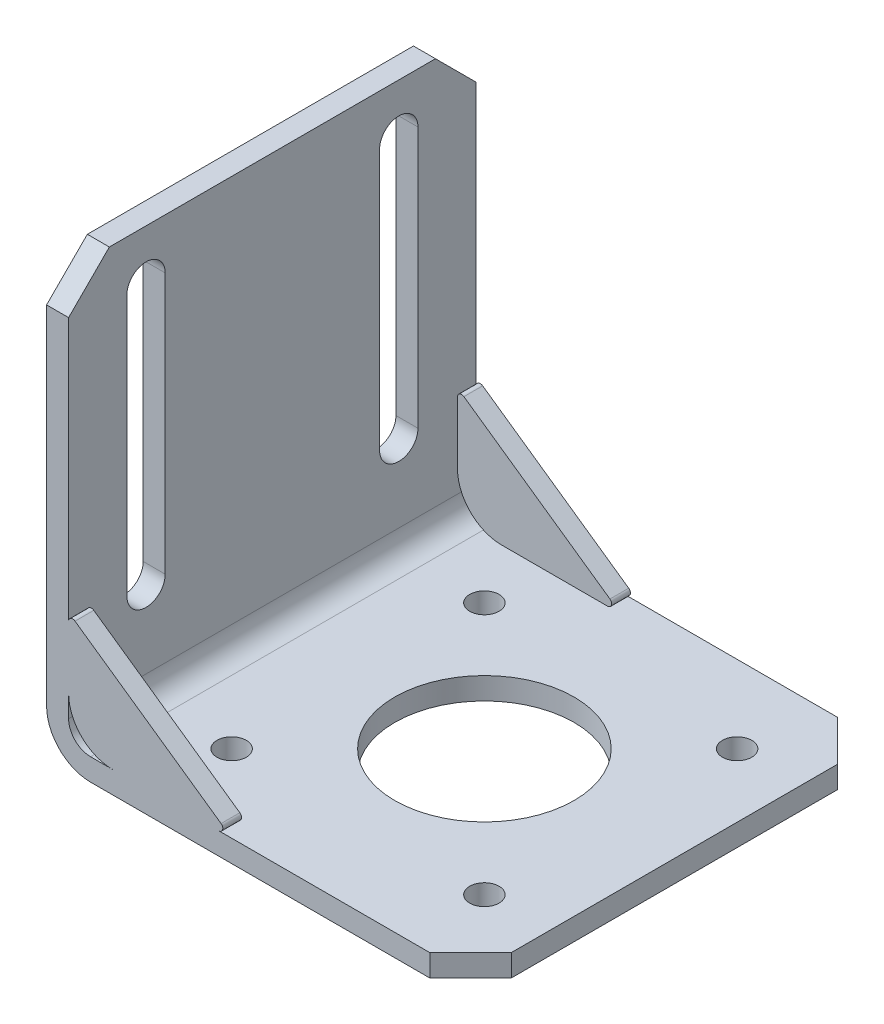
from build123d import *

# Parameters (mm, degrees)
BOSS_EXTRUDE1_DEPTH = 25
SKETCH3_R           = 11
SKETCH3_R_2         = 1.8
CUT_EXTRUDE1_DEPTH  = 50
CHAMFER1_SIZE       = 5
CUT_EXTRUDE2_DEPTH  = 50
BOSS_EXTRUDE2_DEPTH = 2.3


with BuildPart() as part:
    # Sketch1 → Boss-Extrude1 (new, symmetric)
    with BuildSketch(Plane.XY):
        with BuildLine():
            Line((0, 53), (0, 5.4))
            ThreePointArc((0, 5.4), (1.581623382, 1.581623382), (5.4, 0))
            Line((5.4, 0), (52, 0))
            Line((52, 0), (52, 2.7))
            Line((52, 2.7), (5.4, 2.7))
            ThreePointArc((5.4, 2.7), (3.490811691, 3.490811691), (2.7, 5.4))
            Line((2.7, 5.4), (2.7, 53))
            Line((2.7, 53), (0, 53))
        make_face()
    extrude(amount=BOSS_EXTRUDE1_DEPTH, both=True)

    # Sketch3 → Cut-Extrude1 (cut)
    with BuildSketch(Plane(origin=(0, 2.7, 0), x_dir=(1, 0, 0), z_dir=(0, 1, 0))):
        with Locations(Location((28.7, 0, 0), (0, 0, 270))):
            Circle(SKETCH3_R)
        with Locations(Location((44.2, 15.5, 0), (0, 0, 270))):
            Circle(SKETCH3_R_2)
        with Locations(Location((44.2, -15.5, 0), (0, 0, 270))):
            Circle(SKETCH3_R_2)
        with Locations(Location((13.2, -15.5, 0), (0, 0, 270))):
            Circle(SKETCH3_R_2)
        with Locations(Location((13.2, 15.5, 0), (0, 0, 270))):
            Circle(SKETCH3_R_2)
    extrude(amount=-CUT_EXTRUDE1_DEPTH, mode=Mode.SUBTRACT)

    # Chamfer1
    chamfer1_edges = [part.edges().sort_by_distance(p)[0] for p in [
        (1.35, 53, -25),
        (52, 1.35, 25),
        (1.35, 53, 25),
        (52, 1.35, -25),
    ]]
    chamfer(chamfer1_edges, length=CHAMFER1_SIZE)

    # Sketch4 → Cut-Extrude2 (cut)
    with BuildSketch(Plane(origin=(2.7, 0, 0), x_dir=(0, 0, -1), z_dir=(1, 0, 0))):
        with BuildLine():
            Line((-17.851169652, 14.819907576), (-17.851169652, 46.819907056))
            ThreePointArc((-17.851169652, 46.819907056), (-15.5, 49.171076708), (-13.148830348, 46.819907056))
            Line((-13.148830348, 46.819907056), (-13.148830348, 14.819907576))
            ThreePointArc((-13.148830348, 14.819907576), (-15.5, 12.468737404), (-17.851169652, 14.819907576))
        make_face()
        with BuildLine():
            Line((13.148830348, 14.819907576), (13.148830348, 46.819907056))
            ThreePointArc((13.148830348, 46.819907056), (15.5, 49.171076708), (17.851169652, 46.819907056))
            Line((17.851169652, 46.819907056), (17.851169652, 14.819907576))
            ThreePointArc((17.851169652, 14.819907576), (15.5, 12.468737404), (13.148830348, 14.819907576))
        make_face()
    extrude(amount=-CUT_EXTRUDE2_DEPTH, mode=Mode.SUBTRACT)


with BuildPart() as body_2:
    # Sketch5 → Boss-Extrude2 (new body)
    with BuildSketch(Plane(origin=(0, 0, -25), x_dir=(-1, 0, 0), z_dir=(0, 0, -1))):
        with BuildLine():
            Line((-3.486731172, 16.149288179), (-21.400548628, 3.60961596))
            ThreePointArc((-21.400548628, 3.60961596), (-21.5906864, 3.049680308), (-21.113817456, 2.7))
            Line((-21.113817456, 2.7), (-8.1, 2.7))
            ThreePointArc((-8.1, 2.7), (-4.281623382, 4.281623382), (-2.7, 8.1))
            Line((-2.7, 8.1), (-2.7, 15.739672219))
            ThreePointArc((-2.7, 15.739672219), (-2.96909481, 16.183161557), (-3.486731172, 16.149288179))
        make_face()
    boss_extrude2 = extrude(amount=-BOSS_EXTRUDE2_DEPTH)


with BuildPart() as part_1:
    add(part.part)

    # Mirror2: Boss-Extrude2 across plane
    add(boss_extrude2.mirror(Plane.XY))


solid = Compound([body_2.part, part_1.part])
